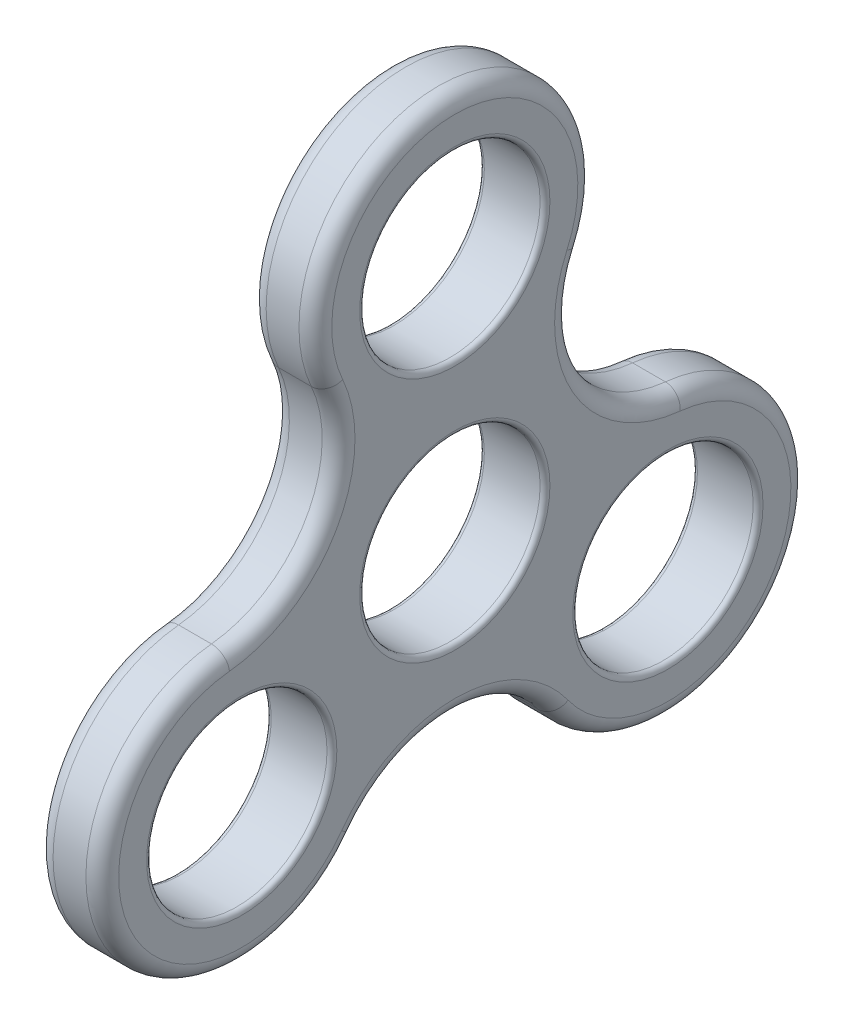
from build123d import *

# Parameters (mm, degrees)
SKETCH_1_R      = 11
EXTRUDE_1_DEPTH = 4
FILLET_1_R      = 2
FILLET_2_R      = 0.6


with BuildPart() as part:
    # 草图1 → 凸台-拉伸1 (new, symmetric)
    with BuildSketch(Plane(origin=(0, 0, 0), x_dir=(0, 0, -1), z_dir=(1, 0, 0))):
        with BuildLine():
            ThreePointArc((15.496068833, 23.009159512), (0, 47), (-15.496068833, 23.009159512))
            ThreePointArc((-15.496068833, 23.009159512), (-16.178689687, 9.340770846), (-27.674551074, 1.915409512))
            ThreePointArc((-27.674551074, 1.915409512), (-40.703193978, -23.5), (-12.178482241, -24.924569024))
            ThreePointArc((-12.178482241, -24.924569024), (0, -18.681541692), (12.178482241, -24.924569024))
            ThreePointArc((12.178482241, -24.924569024), (40.703193978, -23.5), (27.674551074, 1.915409512))
            ThreePointArc((27.674551074, 1.915409512), (16.178689687, 9.340770846), (15.496068833, 23.009159512))
        make_face()
        with Locations((0, 30)):
            Circle(SKETCH_1_R, mode=Mode.SUBTRACT)
        Circle(SKETCH_1_R, mode=Mode.SUBTRACT)
        with Locations((25.980762114, -15)):
            Circle(SKETCH_1_R, mode=Mode.SUBTRACT)
        with Locations((-25.980762114, -15)):
            Circle(SKETCH_1_R, mode=Mode.SUBTRACT)
    extrude(amount=EXTRUDE_1_DEPTH, both=True)

    # 圆角1
    fillet_1_edges = [part.edges().sort_by_distance(p)[0] for p in [
        (-4, 47, 0),
        (-4, 9.340770846, -16.178689687),
        (-4, -23.5, -40.703193978),
        (-4, -18.681541692, 0),
        (-4, -23.5, 40.703193978),
        (4, 47, 0),
        (4, 9.340770846, -16.178689687),
        (4, -23.5, -40.703193978),
        (4, -18.681541692, 0),
        (4, -23.5, 40.703193978),
        (-4, 9.340770846, 16.178689687),
        (4, 9.340770846, 16.178689687),
    ]]
    fillet(fillet_1_edges, radius=FILLET_1_R)

    # 圆角2
    fillet_2_edges = [part.edges().sort_by_distance(p)[0] for p in [
        (-4, -15, 36.980762114),
        (4, -15, 36.980762114),
        (-4, -15, -14.980762114),
        (4, -15, -14.980762114),
        (-4, 0, 11),
        (4, 0, 11),
        (-4, 30, 11),
        (4, 30, 11),
    ]]
    fillet(fillet_2_edges, radius=FILLET_2_R)


solid = part.part
